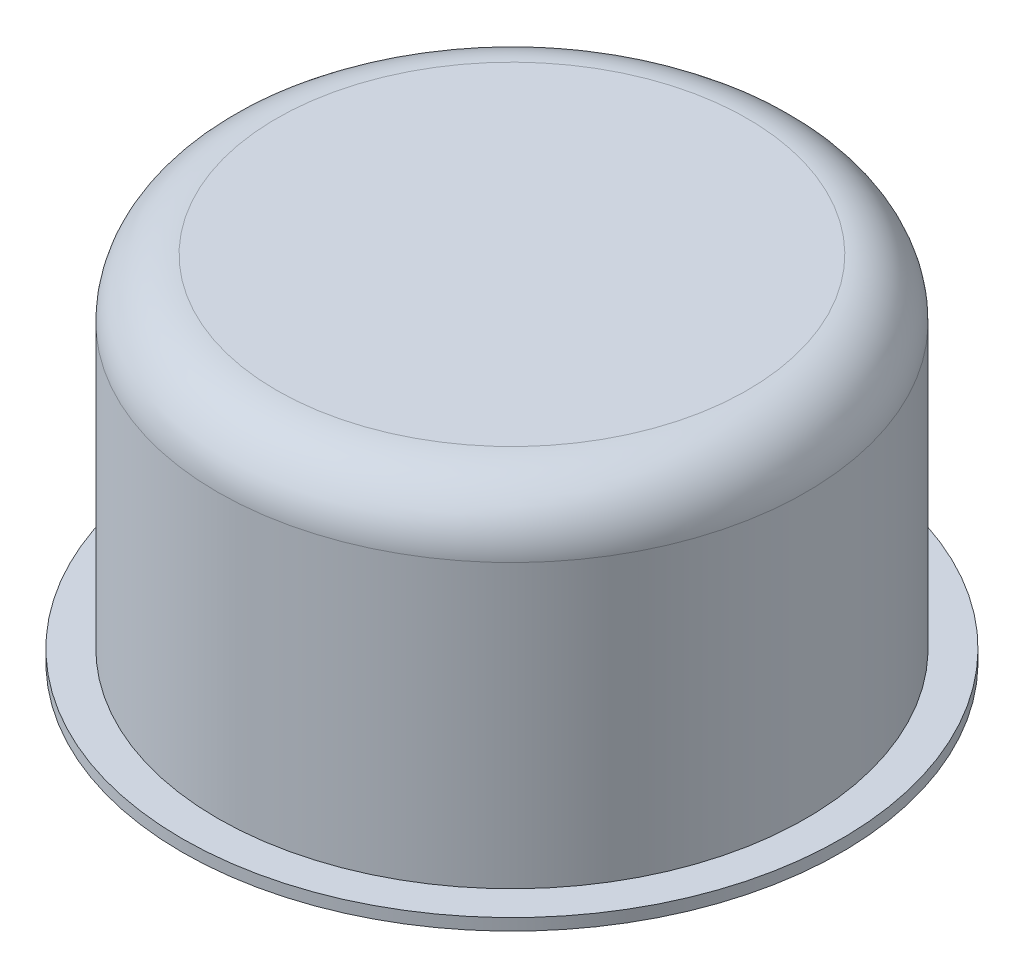
from build123d import *

# Parameters (mm, degrees)
SKETCH1_R           = 12.5
BOSS_EXTRUDE2_DEPTH = 15
SKETCH2_R           = 14
BOSS_EXTRUDE3_DEPTH = 0.5
SKETCH3_R           = 12.25
CUT_EXTRUDE1_DEPTH  = 14.5
FILLET1_R           = 2.5
FILLET2_R           = 2.5


with BuildPart() as part:
    # Sketch1 → Boss-Extrude2 (new body)
    with BuildSketch(Plane(origin=(0, 0, 0), x_dir=(1, 0, 0), z_dir=(0, 1, 0))):
        with Locations(Location((0, 0, 0), (0, 0, 270))):
            Circle(SKETCH1_R)
    extrude(amount=BOSS_EXTRUDE2_DEPTH)

    # Sketch2 → Boss-Extrude3 (add)
    with BuildSketch(Plane(origin=(0, 0, 0), x_dir=(1, 0, 0), z_dir=(0, 1, 0))):
        with Locations(Location((0, 0, 0), (0, 0, 270))):
            Circle(SKETCH2_R)
    extrude(amount=BOSS_EXTRUDE3_DEPTH)

    # Sketch3 → Cut-Extrude1 (cut)
    with BuildSketch(Plane(origin=(0, 0, 0), x_dir=(1, 0, 0), z_dir=(0, 1, 0))):
        with Locations(Location((0, 0, 0), (0, 0, 90))):
            Circle(SKETCH3_R)
    extrude(amount=CUT_EXTRUDE1_DEPTH, mode=Mode.SUBTRACT)

    # Fillet1
    fillet1_edges = [part.edges().sort_by_distance(p)[0] for p in [
        (0, 15, -12.5),
    ]]
    fillet(fillet1_edges, radius=FILLET1_R)

    # Fillet2
    fillet2_edges = [part.edges().sort_by_distance(p)[0] for p in [
        (0, 14.5, 12.25),
    ]]
    fillet(fillet2_edges, radius=FILLET2_R)


solid = part.part
